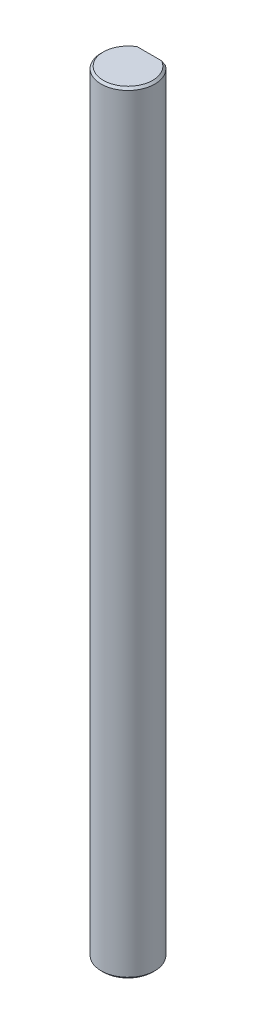
from build123d import *

# Parameters (mm, degrees)
CROQUIS1_R              = 2.5
SALIENTE_EXTRUIR1_DEPTH = 72
CORTAR_EXTRUIR1_START   = -10
CORTAR_EXTRUIR1_DEPTH   = 10
CHAFL_N1_SIZE           = 0.2


with BuildPart() as part:
    # Croquis1 → Saliente-Extruir1 (new body)
    with BuildSketch(Plane(origin=(0, 0, 0), x_dir=(1, 0, 0), z_dir=(0, 1, 0))):
        with Locations(Location((0, 0, 0), (0, 0, 270))):
            Circle(CROQUIS1_R)
    extrude(amount=SALIENTE_EXTRUIR1_DEPTH)

    # Croquis2 → Cortar-Extruir1 (cut)
    with BuildSketch(Plane(origin=(0, 72, 0), x_dir=(1, 0, 0), z_dir=(0, 1, 0)).offset(CORTAR_EXTRUIR1_START)):
        with BuildLine():
            Line((-1.5, 2), (1.5, 2))
            ThreePointArc((1.5, 2), (0, 2.5), (-1.5, 2))
        make_face()
    extrude(amount=CORTAR_EXTRUIR1_DEPTH, mode=Mode.SUBTRACT)

    # Chaflán1
    chafl_n1_edges = [part.edges().sort_by_distance(p)[0] for p in [
        (0, 0, -2.5),
        (-2.371708245, 72, 0.790569415),
    ]]
    chamfer(chafl_n1_edges, length=CHAFL_N1_SIZE)


solid = part.part
